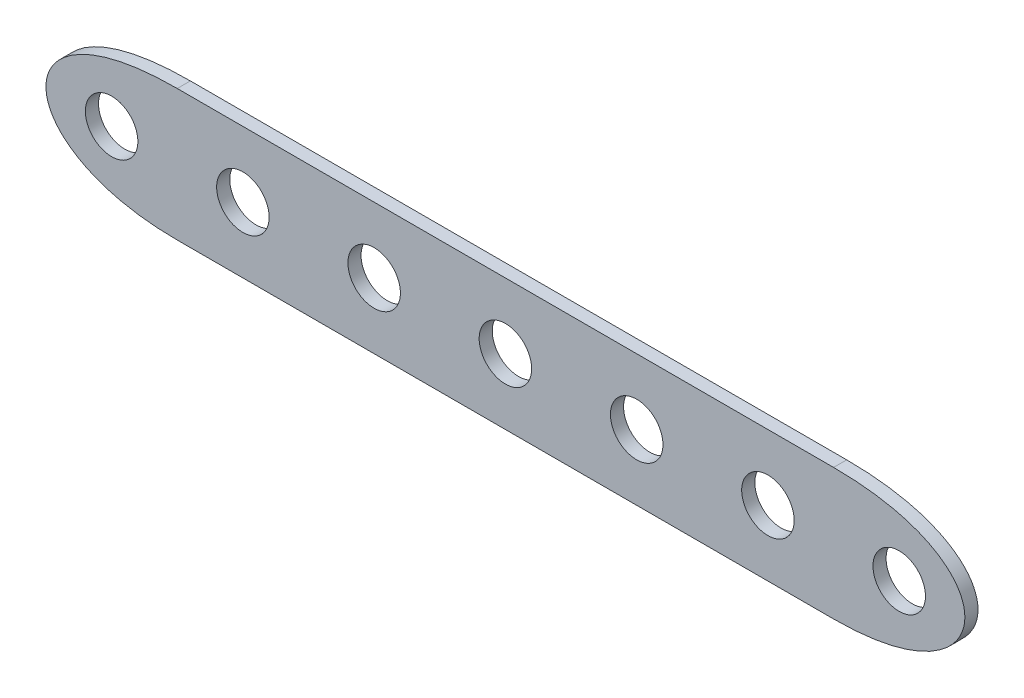
from build123d import *

# Parameters (mm, degrees)
SKETCH_3_R      = 2
EXTRUDE_1_DEPTH = 1


with BuildPart() as part:
    # Эскиз3 → Бобышка-Вытянуть1 (new body)
    with BuildSketch(Plane.XY):
        with BuildLine():
            Line((10, 0), (60, 0))
            add(Edge.make_bspline(
                [(60, 0), (73.743685419, 0), (72.922981248, -10), (60, -10)],
                knots=[0, 0, 0, 0, 1, 1, 1, 1], degree=3))
            Line((60, -10), (10, -10))
            add(Edge.make_bspline(
                [(10, 0), (-3.743685419, 0), (-2.922981248, -10), (10, -10)],
                knots=[0, 0, 0, 0, 1, 1, 1, 1], degree=3))
        make_face()
        with Locations((5, -5)):
            Circle(SKETCH_3_R, mode=Mode.SUBTRACT)
        with Locations((65, -5)):
            Circle(SKETCH_3_R, mode=Mode.SUBTRACT)
        with Locations((15, -5)):
            Circle(SKETCH_3_R, mode=Mode.SUBTRACT)
        with Locations((25, -5)):
            Circle(SKETCH_3_R, mode=Mode.SUBTRACT)
        with Locations((35, -5)):
            Circle(SKETCH_3_R, mode=Mode.SUBTRACT)
        with Locations((45, -5)):
            Circle(SKETCH_3_R, mode=Mode.SUBTRACT)
        with Locations((55, -5)):
            Circle(SKETCH_3_R, mode=Mode.SUBTRACT)
    extrude(amount=EXTRUDE_1_DEPTH)


solid = part.part
